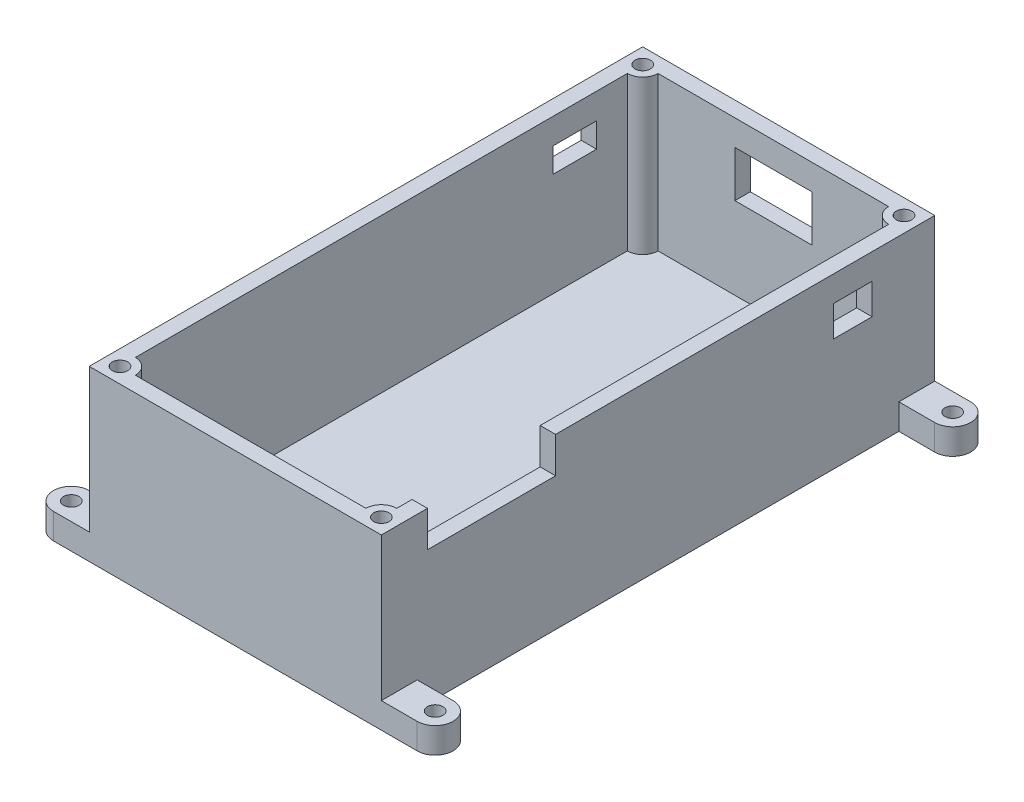
from build123d import *

# Parameters (mm, degrees)
CROQUIS1_W              = 51
CROQUIS1_H              = 102
SALIENTE_EXTRUIR1_DEPTH = 30
VACIADO1_T              = 3
CROQUIS5_R              = 1.5
SALIENTE_EXTRUIR2_DEPTH = 5
CROQUIS8_R              = 3
SALIENTE_EXTRUIR3_DEPTH = 30
CROQUIS10_R             = 1.5
CORTAR_EXTRUIR1_DEPTH   = 25
CROQUIS14_W             = 25
CROQUIS14_H             = 7
CORTAR_EXTRUIR3_DEPTH   = 3
CROQUIS15_W             = 8.5
CROQUIS15_H             = 4.8
CORTAR_EXTRUIR4_DEPTH   = 3
CROQUIS16_W             = 7.48
CROQUIS16_H             = 6
CORTAR_EXTRUIR5_DEPTH   = 3
CROQUIS17_R             = 2.5
CORTAR_EXTRUIR6_DEPTH   = 3
CROQUIS18_W             = 15
CROQUIS18_H             = 9
CORTAR_EXTRUIR7_DEPTH   = 54


with BuildPart() as part:
    # Croquis1 → Saliente-Extruir1 (new body)
    with BuildSketch(Plane(origin=(0, 0, 0), x_dir=(1, 0, 0), z_dir=(0, 1, 0))):
        Rectangle(CROQUIS1_W, CROQUIS1_H)
    extrude(amount=SALIENTE_EXTRUIR1_DEPTH)

    # Vaciado1
    vaciado1_openings = [part.faces().sort_by_distance(p)[0] for p in [
        (0, 30, 0),
    ]]
    offset(amount=VACIADO1_T, openings=vaciado1_openings, kind=Kind.INTERSECTION)

    # Croquis5 → Saliente-Extruir2 (add)
    # profile 1 of 4: a face of its own
    with BuildSketch(Plane.XZ.offset(3)):
        with BuildLine():
            Line((28.5, 54), (35.5, 54))
            ThreePointArc((35.5, 54), (38.999999038, 50.49999936), (35.49999872, 47))
            Line((35.49999872, 47), (28.5, 47))
            Line((28.5, 47), (28.5, 54))
        make_face()
        with Locations(Location((35.499999038, 50.5, 0), (0, 0, 270))):
            Circle(CROQUIS5_R, mode=Mode.SUBTRACT)
    # profile 2 of 4: a face of its own
    with BuildSketch(Plane.XZ.offset(3)):
        with BuildLine():
            Line((-28.5, 54), (-35.5, 54))
            ThreePointArc((-35.5, 54), (-38.999999054, 50.499999378), (-35.499998756, 47))
            Line((-35.499998756, 47), (-28.5, 47))
            Line((-28.5, 47), (-28.5, 54))
        make_face()
        with Locations(Location((-35.499999054, 50.5, 0), (0, 0, 270))):
            Circle(CROQUIS5_R, mode=Mode.SUBTRACT)
    # profile 3 of 4: a face of its own
    with BuildSketch(Plane.XZ.offset(3)):
        with BuildLine():
            Line((-28.5, -54), (-35.5, -54))
            ThreePointArc((-35.5, -54), (-38.999999038, -50.49999936), (-35.49999872, -47))
            Line((-35.49999872, -47), (-28.5, -47))
            Line((-28.5, -47), (-28.5, -54))
        make_face()
        with Locations(Location((-35.499999038, -50.5, 0), (0, 0, 270))):
            Circle(CROQUIS5_R, mode=Mode.SUBTRACT)
    # profile 4 of 4: a face of its own
    with BuildSketch(Plane.XZ.offset(3)):
        with BuildLine():
            Line((28.5, -54), (35.5, -54))
            ThreePointArc((35.5, -54), (38.999999041, -50.499999359), (35.499998718, -47))
            Line((35.499998718, -47), (28.5, -47))
            Line((28.5, -47), (28.5, -54))
        make_face()
        with Locations(Location((35.499999041, -50.5, 0), (0, 0, 270))):
            Circle(CROQUIS5_R, mode=Mode.SUBTRACT)
    extrude(amount=-SALIENTE_EXTRUIR2_DEPTH)

    # Croquis8 → Saliente-Extruir3 (add)
    with BuildSketch(Plane(origin=(0, 0, 0), x_dir=(1, 0, 0), z_dir=(0, 1, 0))):
        with Locations((-25.5, 51)):
            Circle(CROQUIS8_R)
        with Locations((25.5, 51)):
            Circle(CROQUIS8_R)
        with Locations((25.5, -51)):
            Circle(CROQUIS8_R)
        with Locations((-25.5, -51)):
            Circle(CROQUIS8_R)
    extrude(amount=SALIENTE_EXTRUIR3_DEPTH)

    # Croquis10 → Cortar-Extruir1 (cut)
    with BuildSketch(Plane(origin=(0, 30, 0), x_dir=(1, 0, 0), z_dir=(0, 1, 0))):
        with Locations(Location((-25.5, 51, 0), (0, 0, 270))):
            Circle(CROQUIS10_R)
        with Locations(Location((25.5, 51, 0), (0, 0, 270))):
            Circle(CROQUIS10_R)
        with Locations(Location((-25.5, -51, 0), (0, 0, 270))):
            Circle(CROQUIS10_R)
        with Locations(Location((25.5, -51, 0), (0, 0, 270))):
            Circle(CROQUIS10_R)
    extrude(amount=-CORTAR_EXTRUIR1_DEPTH, mode=Mode.SUBTRACT)

    # Croquis14 → Cortar-Extruir3 (cut)
    with BuildSketch(Plane(origin=(28.5, 0, 0), x_dir=(0, 0, -1), z_dir=(1, 0, 0))):
        with Locations((-32.5, 26.5)):
            Rectangle(CROQUIS14_W, CROQUIS14_H)
    extrude(amount=-CORTAR_EXTRUIR3_DEPTH, mode=Mode.SUBTRACT)

    # Croquis15 → Cortar-Extruir4 (cut)
    with BuildSketch(Plane.ZY.offset(28.5)):
        with Locations((-37.75, 22.6)):
            Rectangle(CROQUIS15_W, CROQUIS15_H)
    extrude(amount=-CORTAR_EXTRUIR4_DEPTH, mode=Mode.SUBTRACT)

    # Croquis16 → Cortar-Extruir5 (cut)
    with BuildSketch(Plane(origin=(28.5, 0, 0), x_dir=(0, 0, -1), z_dir=(1, 0, 0))):
        with Locations((38.02, 22)):
            Rectangle(CROQUIS16_W, CROQUIS16_H)
    extrude(amount=-CORTAR_EXTRUIR5_DEPTH, mode=Mode.SUBTRACT)

    # Croquis17 → Cortar-Extruir6 (cut)
    with BuildSketch(Plane.XZ.offset(3)):
        with Locations(Location((0, -42, 0), (0, 0, 270))):
            Circle(CROQUIS17_R)
    extrude(amount=-CORTAR_EXTRUIR6_DEPTH, mode=Mode.SUBTRACT)

    # Croquis18 → Cortar-Extruir7 (cut)
    with BuildSketch(Plane(origin=(0, 0, -54), x_dir=(-1, 0, 0), z_dir=(0, 0, -1))):
        with Locations((0, 20.5)):
            Rectangle(CROQUIS18_W, CROQUIS18_H)
    extrude(amount=-CORTAR_EXTRUIR7_DEPTH, mode=Mode.SUBTRACT)


solid = part.part
